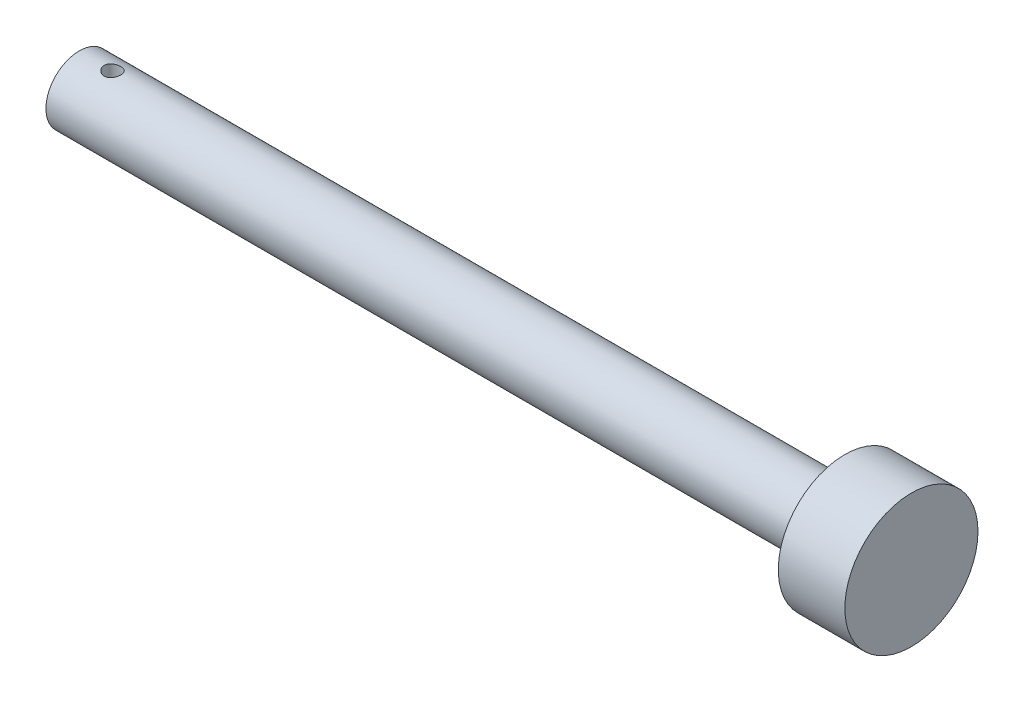
from build123d import *

# Parameters (mm, degrees)
SKETCH1_R               = 16
BOSS_EXTRUDE1_DEPTH     = 16
SKETCH2_R               = 8
BOSS_EXTRUDE2_DEPTH     = 200
CUT_EXTRUDE2_DEPTH      = 186.38608362
CUT_EXTRUDE2_DEPTH_BACK = 186.38608362
SKETCH3_R               = 2


with BuildPart() as part:
    # Sketch1 → Boss-Extrude1 (new body)
    with BuildSketch(Plane(origin=(0, 0, 0), x_dir=(0, 0, -1), z_dir=(1, 0, 0))):
        Circle(SKETCH1_R)
    extrude(amount=BOSS_EXTRUDE1_DEPTH)

    # Sketch2 → Boss-Extrude2 (add)
    with BuildSketch(Plane(origin=(16, 0, 0), x_dir=(0, 0, -1), z_dir=(1, 0, 0))):
        Circle(SKETCH2_R)
    extrude(amount=-BOSS_EXTRUDE2_DEPTH)

    # Sketch3 → Cut-Extrude2 (cut, two sides: drawn at the far end of the back side and taken through both)
    with BuildSketch(Plane(origin=(0, 0, 0), x_dir=(1, 0, 0), z_dir=(0, 1, 0)).offset(-CUT_EXTRUDE2_DEPTH_BACK)):
        with Locations(Location((-176, 0, 0), (0, 0, 270))):
            Circle(SKETCH3_R)
    extrude(amount=CUT_EXTRUDE2_DEPTH + CUT_EXTRUDE2_DEPTH_BACK, mode=Mode.SUBTRACT)


solid = part.part
